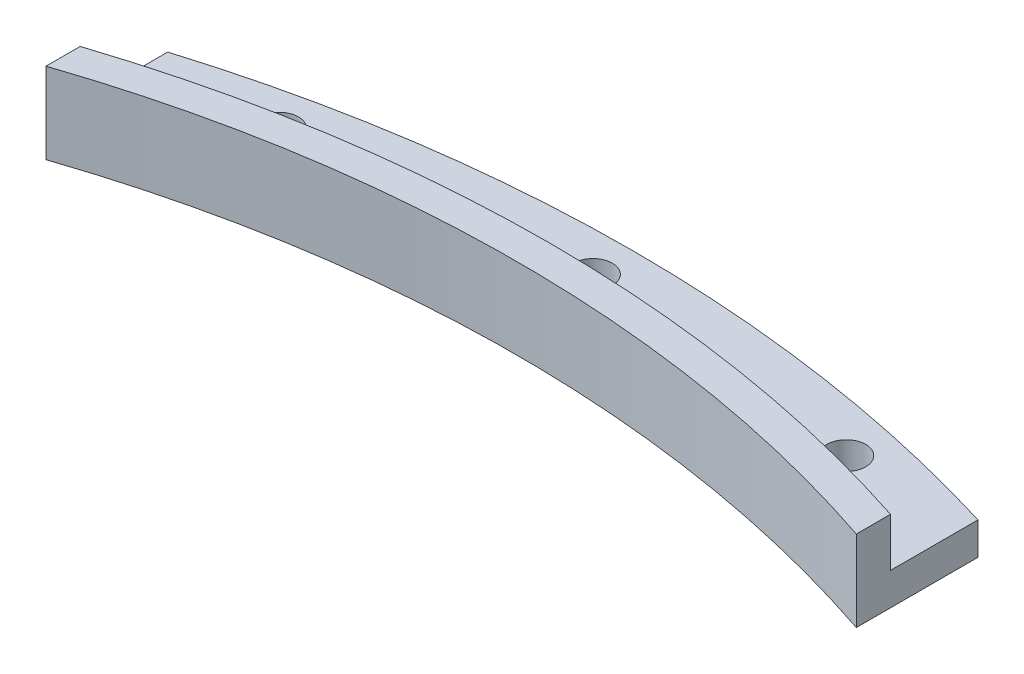
from build123d import *

# Parameters (mm, degrees)
EXTRUDE_1_DEPTH   = 2
EXTRUDE_2_DEPTH   = 5
HOLE_WIZARD_M21_D = 2.4


with BuildPart() as part:
    # Эскиз1 → Бобышка-Вытянуть1 (new body)
    with BuildSketch(Plane(origin=(0, 0, 0), x_dir=(1, 0, 0), z_dir=(0, 1, 0))):
        with BuildLine():
            ThreePointArc((0, 0), (-25, 3.980394669), (-50, 0))
            Line((-50, 0), (-50, 5.4))
            ThreePointArc((-50, 5.4), (-25, 9.13662189), (0, 5.4))
            Line((0, 5.4), (0, 0))
        make_face()
    extrude(amount=EXTRUDE_1_DEPTH)

    # Эскиз1<3> → Бобышка-Вытянуть2 (add)
    with BuildSketch(Plane(origin=(0, 0, 0), x_dir=(1, 0, 0), z_dir=(0, 1, 0))):
        with BuildLine():
            Line((-50, -2.106904802), (-50, 0))
            ThreePointArc((-50, 0), (-25, 3.980394669), (0, 0))
            Line((0, 0), (0, -2.106904802))
            ThreePointArc((0, -2.106904802), (-25, 1.980394669), (-50, -2.106904802))
        make_face()
    extrude(amount=EXTRUDE_2_DEPTH)

    # Отверстие с зазором M21 (through all)
    with Locations(Plane(origin=(0, 0, 0), x_dir=(-1, 0, 0), z_dir=(0, -1, 0))):
        with Locations((42.5, 4.770770064), (25, 6.63662189), (7.5, 4.770770064)):
            Hole(HOLE_WIZARD_M21_D / 2)


solid = part.part
